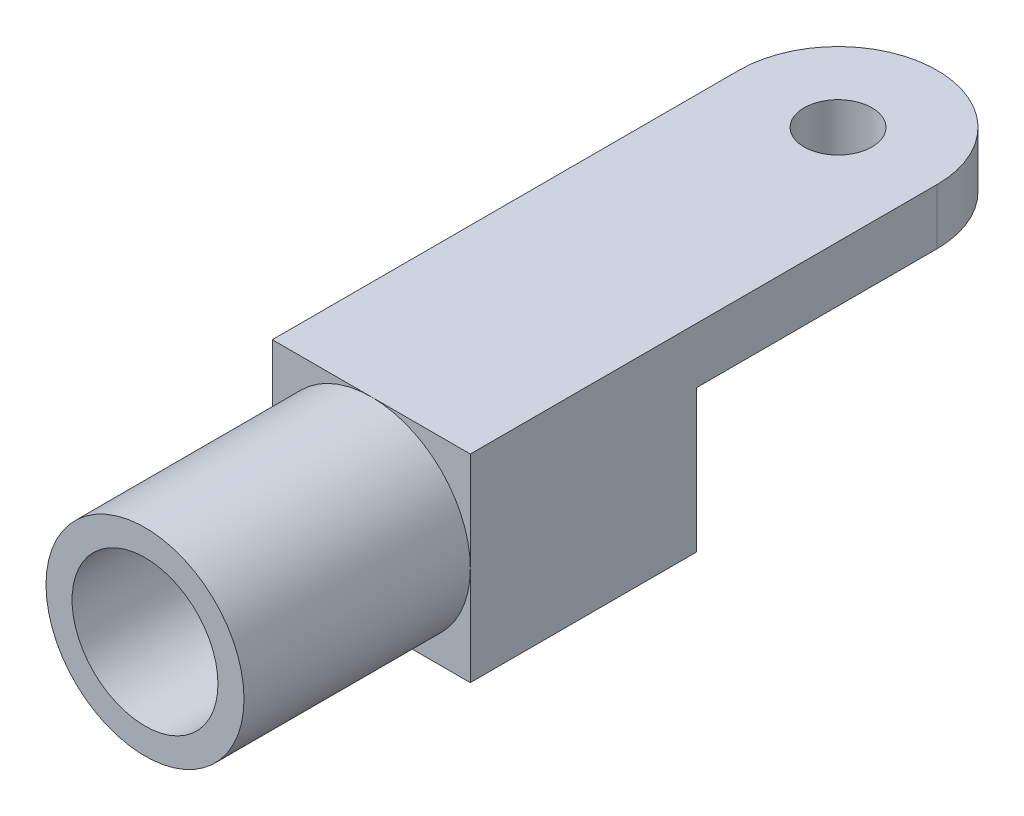
from build123d import *

# Parameters (mm, degrees)
SKETCH1_R           = 4.445
SKETCH1_R_2         = 3.275000003
BOSS_EXTRUDE1_DEPTH = 10.16
SKETCH2_W           = 8.89
SKETCH2_H           = 8.89
BOSS_EXTRUDE2_DEPTH = 25.4
CUT_EXTRUDE1_DEPTH  = 28.275449126
SKETCH4_W           = 15.24
SKETCH4_H           = 6.39064
CUT_EXTRUDE2_DEPTH  = 28.275449126


with BuildPart() as part:
    # Sketch1 → Boss-Extrude1 (new body)
    with BuildSketch(Plane.XY):
        Circle(SKETCH1_R)
        Circle(SKETCH1_R_2, mode=Mode.SUBTRACT)
    extrude(amount=BOSS_EXTRUDE1_DEPTH)

    # Sketch2 → Boss-Extrude2 (add)
    with BuildSketch(Plane(origin=(0, 0, 0), x_dir=(-1, 0, 0), z_dir=(0, 0, -1))):
        Rectangle(SKETCH2_W, SKETCH2_H)
    extrude(amount=BOSS_EXTRUDE2_DEPTH)

    # Sketch3 → Cut-Extrude1 (cut, through all)
    with BuildSketch(Plane.XZ.offset(4.445)):
        with BuildLine():
            Line((4.445, -25.4), (4.445, -20.955))
            ThreePointArc((4.445, -20.955), (3.143089642, -24.098089642), (0, -25.4))
            Line((0, -25.4), (4.445, -25.4))
        make_face()
        with BuildLine():
            ThreePointArc((0, -25.4), (-3.143089642, -24.098089642), (-4.445, -20.955))
            Line((-4.445, -20.955), (-4.445, -25.4))
            Line((-4.445, -25.4), (0, -25.4))
        make_face()
        with BuildLine():
            ThreePointArc((1.524, -20.955), (0, -19.431), (-1.524, -20.955))
            Line((-1.524, -20.955), (1.524, -20.955))
        make_face()
        with BuildLine():
            Line((1.524, -20.955), (-1.524, -20.955))
            ThreePointArc((-1.524, -20.955), (0, -22.479), (1.524, -20.955))
        make_face()
    extrude(amount=-CUT_EXTRUDE1_DEPTH, mode=Mode.SUBTRACT)

    # Sketch4 → Cut-Extrude2 (cut, through all)
    with BuildSketch(Plane.ZY.offset(4.445)):
        with Locations((-17.78, -1.24968)):
            Rectangle(SKETCH4_W, SKETCH4_H)
    extrude(amount=-CUT_EXTRUDE2_DEPTH, mode=Mode.SUBTRACT)


solid = part.part
